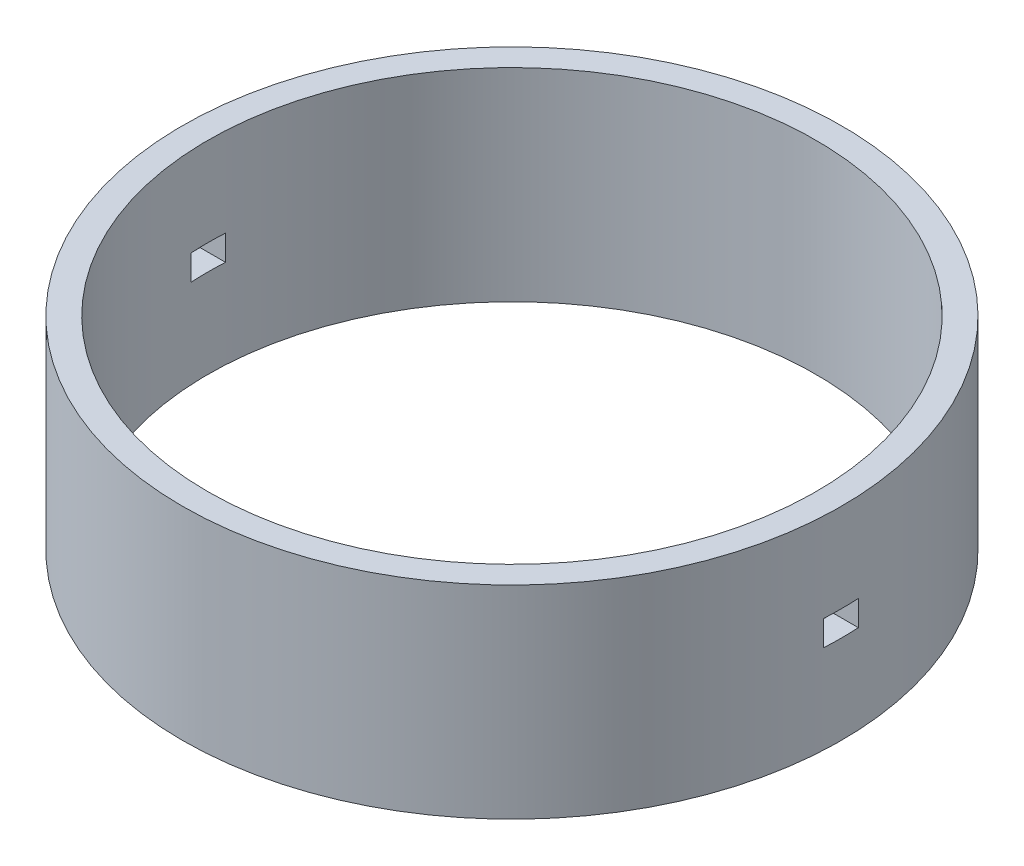
from build123d import *

# Parameters (mm, degrees)
SKETCH1_R               = 1981.2
SKETCH1_R_2             = 1828.8
BOSS_EXTRUDE1_DEPTH     = 609.6
CUT_EXTRUDE1_DEPTH      = 2868.388888867
CUT_EXTRUDE1_DEPTH_BACK = 2868.388888867
SKETCH2_W               = 208.28
SKETCH2_H               = 152.4


with BuildPart() as part:
    # Sketch1 → Boss-Extrude1 (new, symmetric)
    with BuildSketch(Plane(origin=(0, 0, 0), x_dir=(1, 0, 0), z_dir=(0, 1, 0))):
        with Locations(Location((0, 0, 0), (0, 0, 90))):
            Circle(SKETCH1_R)
        with Locations(Location((0, 0, 0), (0, 0, 90))):
            Circle(SKETCH1_R_2, mode=Mode.SUBTRACT)
    extrude(amount=BOSS_EXTRUDE1_DEPTH, both=True)

    # Sketch2 → Cut-Extrude1 (cut, two sides: drawn at the far end of the back side and taken through both)
    with BuildSketch(Plane(origin=(0, 0, 0), x_dir=(0, 0, -1), z_dir=(1, 0, 0)).offset(-CUT_EXTRUDE1_DEPTH_BACK)):
        Rectangle(SKETCH2_W, SKETCH2_H)
    extrude(amount=CUT_EXTRUDE1_DEPTH + CUT_EXTRUDE1_DEPTH_BACK, mode=Mode.SUBTRACT)


solid = part.part
